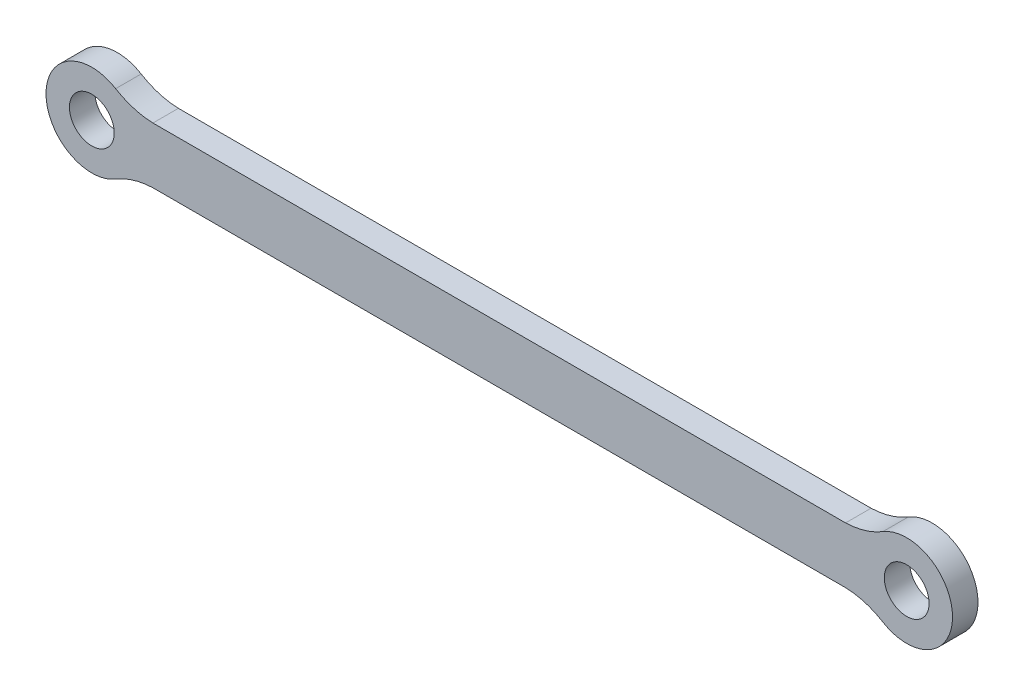
from build123d import *

# Parameters (mm, degrees)
ESQUISSE1_R        = 4.4
BOSS_EXTRU_1_DEPTH = 5


with BuildPart() as part:
    # Esquisse1 → Boss.-Extru.1 (new body)
    with BuildSketch(Plane.XY):
        with BuildLine():
            Line((68, 5.507634318), (-68, 5.507634318))
            ThreePointArc((-68, 5.507634318), (-71.801069942, 6.123863241), (-75.320005991, 7.687499989))
            ThreePointArc((-75.320005991, 7.687499989), (-89, 0), (-75.320005991, -7.687499989))
            ThreePointArc((-75.320005991, -7.687499989), (-71.801069944, -6.123863232), (-68, -5.5076343))
            Line((-68, -5.5076343), (68, -5.5076343))
            ThreePointArc((68, -5.5076343), (71.801069954, -6.123863235), (75.320006009, -7.6875))
            ThreePointArc((75.320006009, -7.6875), (89, 0), (75.320006009, 7.6875))
            ThreePointArc((75.320006009, 7.6875), (71.801069953, 6.123863244), (68, 5.507634318))
        make_face()
        with Locations((-80, 0)):
            Circle(ESQUISSE1_R, mode=Mode.SUBTRACT)
        with Locations((80, 0)):
            Circle(ESQUISSE1_R, mode=Mode.SUBTRACT)
    extrude(amount=BOSS_EXTRU_1_DEPTH)


solid = part.part
